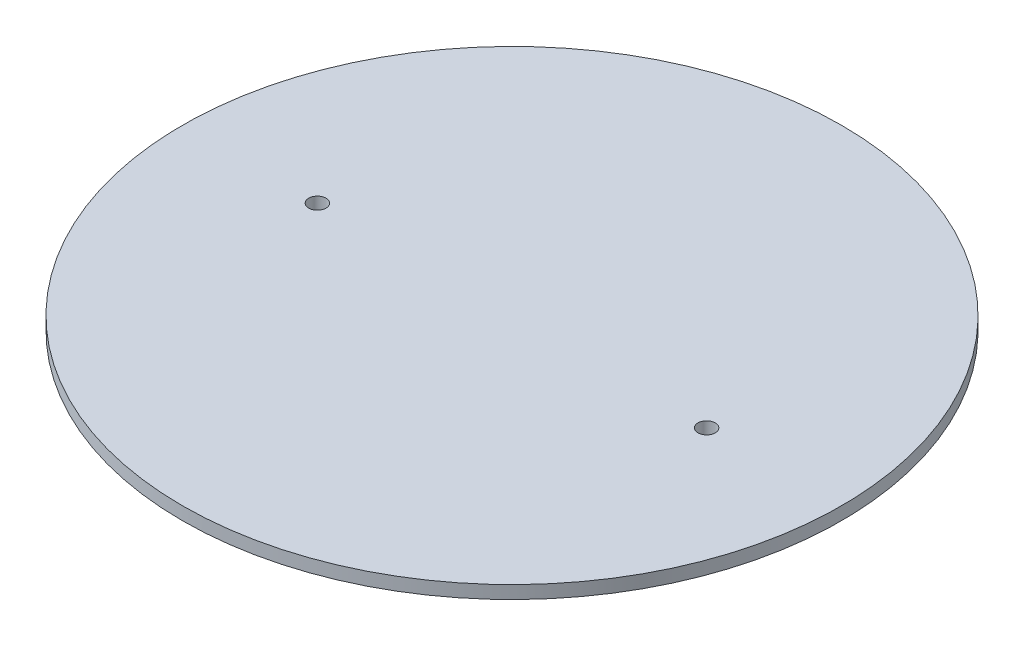
from build123d import *

# Parameters (mm, degrees)
SKETCH1_R           = 76.2
SKETCH1_R_2         = 2
BOSS_EXTRUDE1_DEPTH = 3


with BuildPart() as part:
    # Sketch1 → Boss-Extrude1 (new body)
    with BuildSketch(Plane(origin=(0, 0, 0), x_dir=(1, 0, 0), z_dir=(0, 1, 0))):
        with Locations(Location((0, 0, 0), (0, 0, 270))):
            Circle(SKETCH1_R)
        with Locations(Location((45, 0, 0), (0, 0, 270))):
            Circle(SKETCH1_R_2, mode=Mode.SUBTRACT)
        with Locations(Location((-45, 0, 0), (0, 0, 270))):
            Circle(SKETCH1_R_2, mode=Mode.SUBTRACT)
    extrude(amount=BOSS_EXTRUDE1_DEPTH)


solid = part.part
